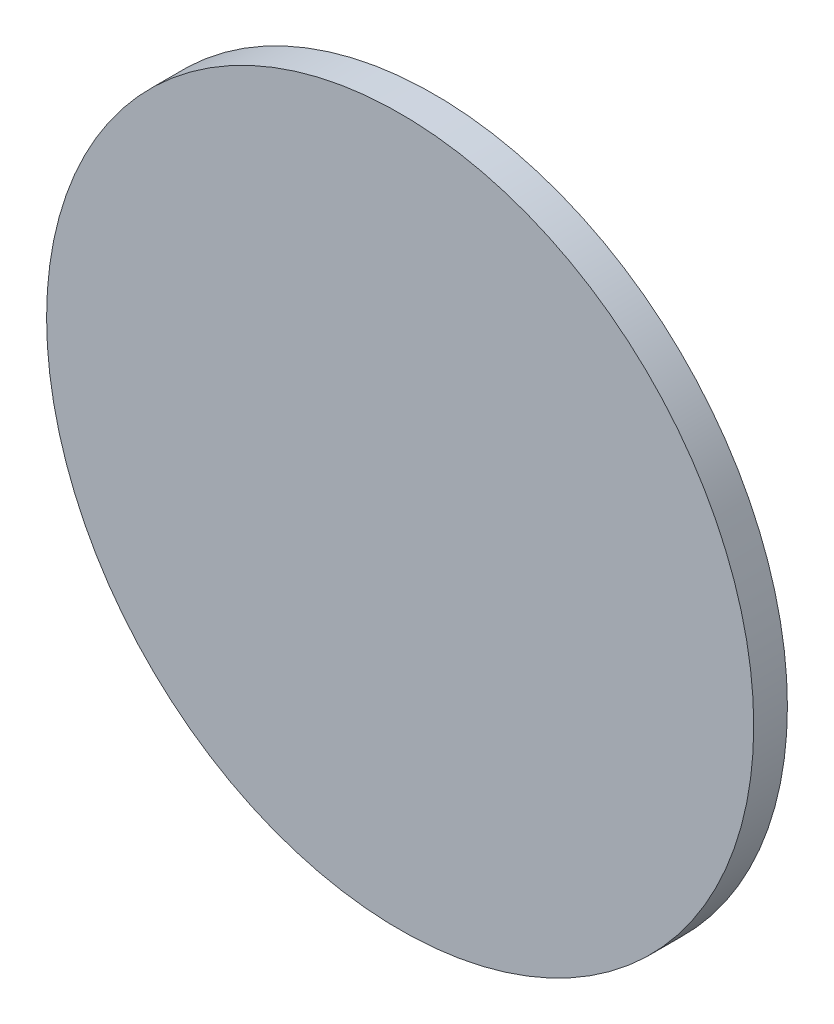
from build123d import *

# Parameters (mm, degrees)
SKETCH_1_R      = 21
EXTRUDE_1_DEPTH = 2


with BuildPart() as part:
    # Эскиз1 → Бобышка-Вытянуть1 (new body)
    with BuildSketch(Plane.XY):
        Circle(SKETCH_1_R)
    extrude(amount=EXTRUDE_1_DEPTH)


solid = part.part
